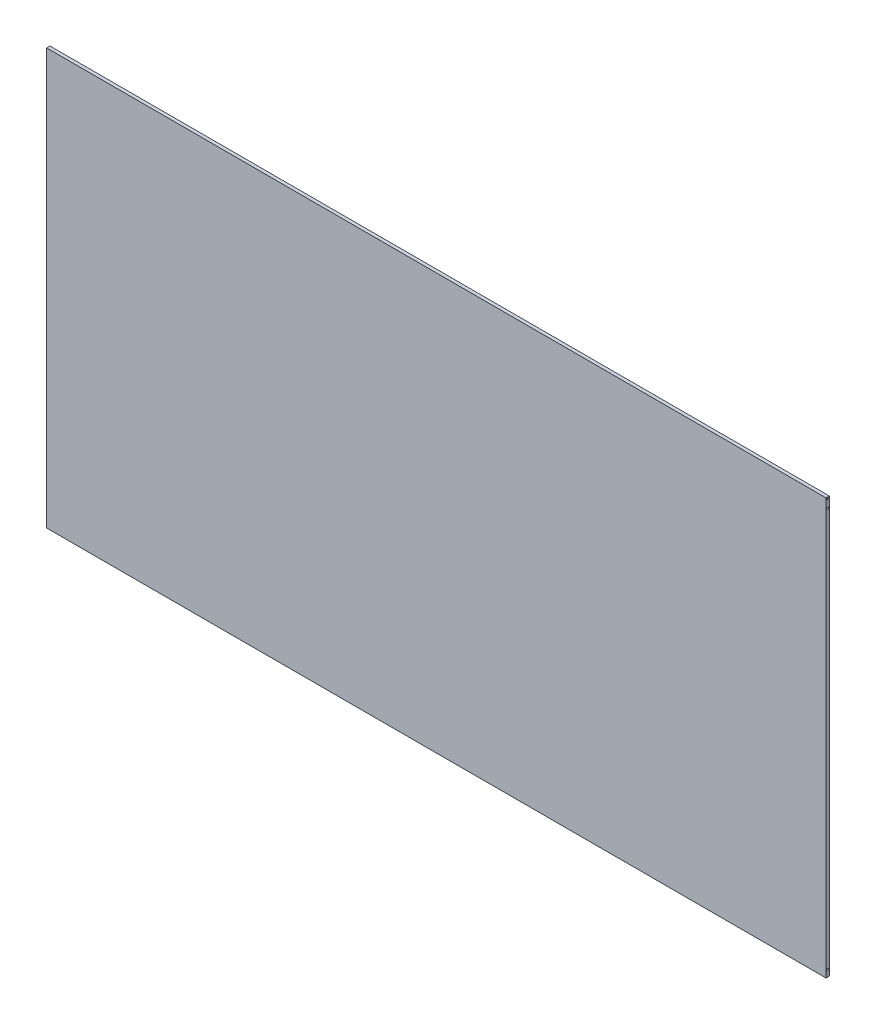
from build123d import *

# Parameters (mm, degrees)
SKETCH1_W           = 1190
SKETCH1_H           = 635
BOSS_EXTRUDE1_DEPTH = 5
SKETCH2_R           = 1.2
SKETCH2_R_2         = 1.5
CUT_EXTRUDE1_DEPTH  = 10
CUT_EXTRUDE2_START  = -10
SKETCH4_R           = 1.5
CUT_EXTRUDE2_DEPTH  = 10
SKETCH5_R           = 1.2
CUT_EXTRUDE3_DEPTH  = 10


with BuildPart() as part:
    # Sketch1 → Boss-Extrude1 (new body)
    with BuildSketch(Plane.XY):
        Rectangle(SKETCH1_W, SKETCH1_H)
    extrude(amount=BOSS_EXTRUDE1_DEPTH)

    # Sketch2 → Cut-Extrude1 (cut)
    with BuildSketch(Plane.ZY.offset(595)):
        with Locations((2.5, -320)):
            Circle(SKETCH2_R)
        with Locations((2.5, 302.5)):
            Circle(SKETCH2_R_2)
    extrude(amount=-CUT_EXTRUDE1_DEPTH, mode=Mode.SUBTRACT)

    # Sketch4 → Cut-Extrude2 (cut)
    with BuildSketch(Plane(origin=(595, 0, 0), x_dir=(0, 0, -1), z_dir=(1, 0, 0)).offset(CUT_EXTRUDE2_START)):
        with Locations(Location((-2.5, 302.5, 0), (0, 0, 180))):
            Circle(SKETCH4_R)
        with Locations((-2.5, -307.5)):
            Circle(SKETCH4_R)
    extrude(amount=CUT_EXTRUDE2_DEPTH, mode=Mode.SUBTRACT)

    # Sketch5 → Cut-Extrude3 (cut)
    with BuildSketch(Plane(origin=(595, 0, 0), x_dir=(0, 0, -1), z_dir=(1, 0, 0))):
        with Locations((-2.5, 315)):
            Circle(SKETCH5_R)
    extrude(amount=-CUT_EXTRUDE3_DEPTH, mode=Mode.SUBTRACT)


solid = part.part
